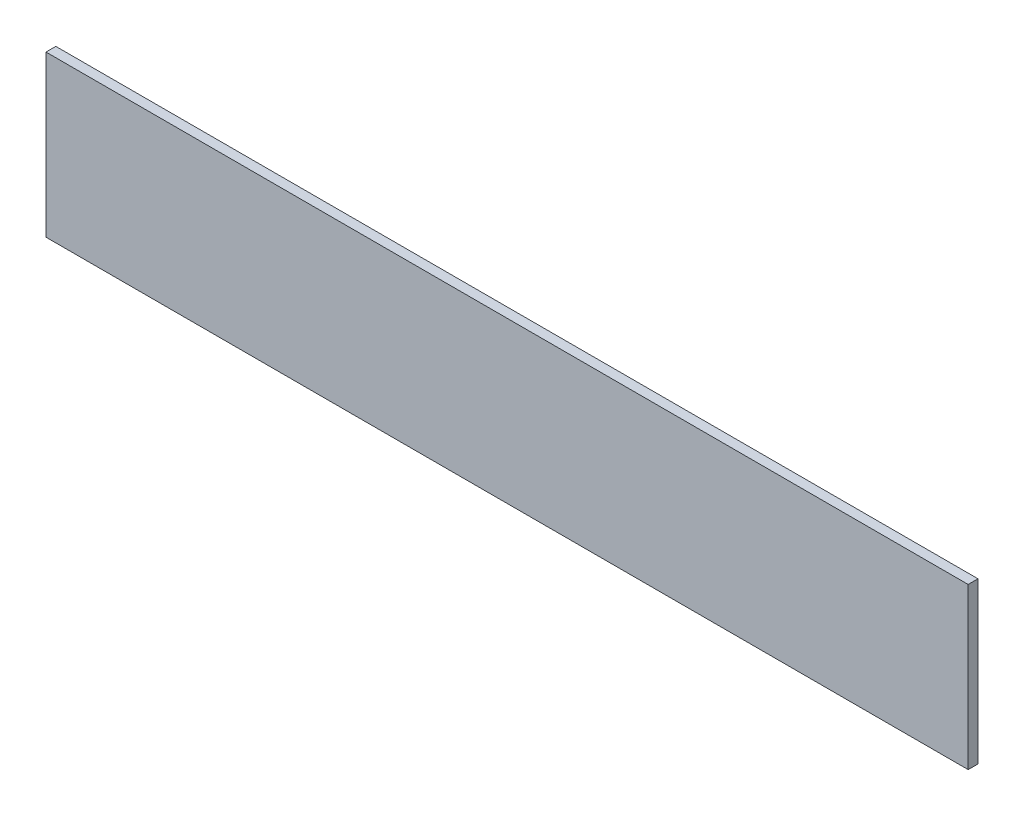
from build123d import *

# Parameters (mm, degrees)
SKETCH1_W           = 219.075
SKETCH1_H           = 38.1
BOSS_EXTRUDE1_DEPTH = 2.3368


with BuildPart() as part:
    # Sketch1 → Boss-Extrude1 (new body)
    with BuildSketch(Plane.XY):
        with Locations((-118.11, 40.719375)):
            Rectangle(SKETCH1_W, SKETCH1_H)
    extrude(amount=BOSS_EXTRUDE1_DEPTH)


solid = part.part
